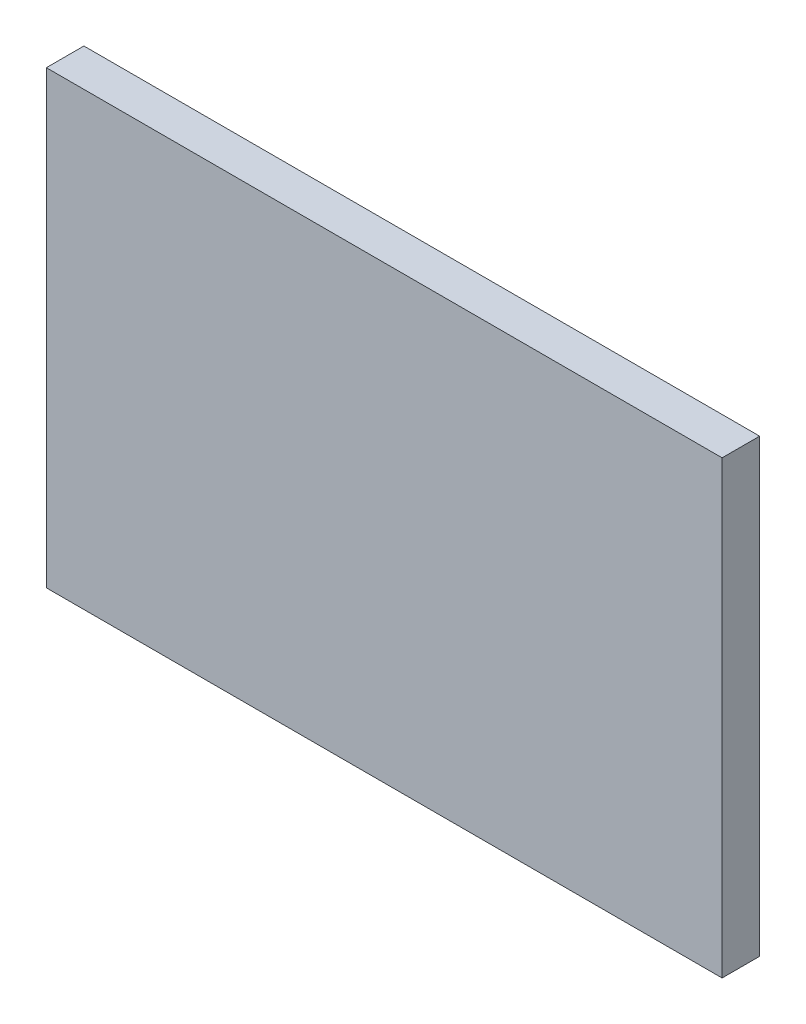
from build123d import *

# Parameters (mm, degrees)
SKETCH1_W           = 90
SKETCH1_H           = 60
BOSS_EXTRUDE1_DEPTH = 5


with BuildPart() as part:
    # Sketch1 → Boss-Extrude1 (new body)
    with BuildSketch(Plane.XY):
        with Locations((-81.987951807, 18.43373494)):
            Rectangle(SKETCH1_W, SKETCH1_H)
    extrude(amount=BOSS_EXTRUDE1_DEPTH)


solid = part.part
